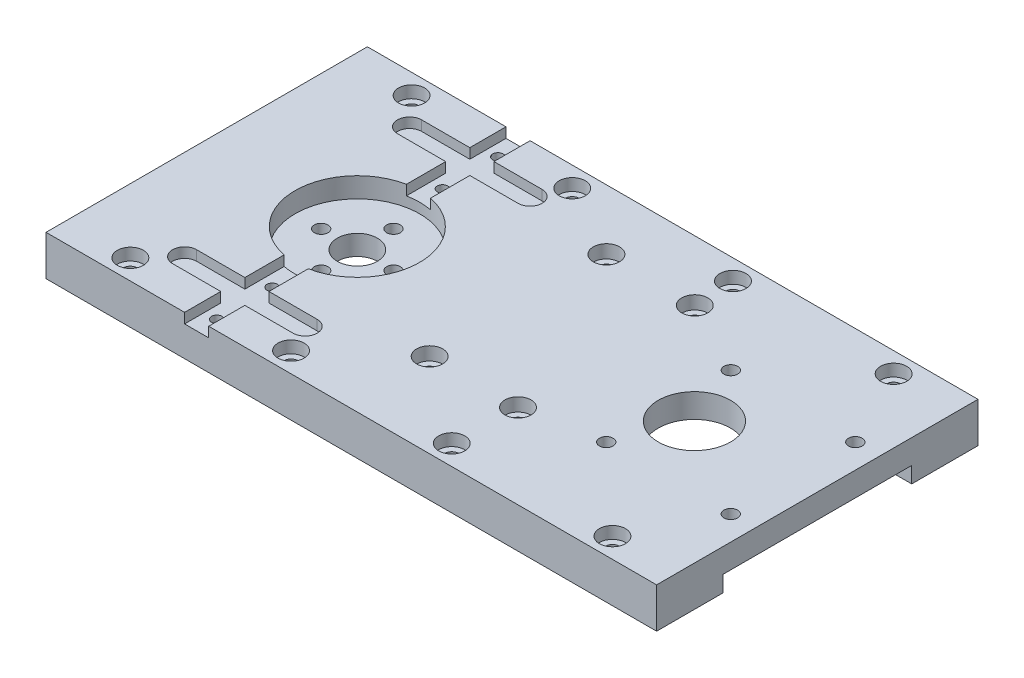
from build123d import *

# Parameters (mm, degrees)
SKETCH1_W                                = 152
SKETCH1_H                                = 80
BOSS_EXTRUDE1_DEPTH                      = 10
SKETCH2_R                                = 15.5
CUT_EXTRUDE1_DEPTH                       = 5
SKETCH3_R                                = 5
CUT_EXTRUDE2_DEPTH                       = 5
CUT_EXTRUDE3_DEPTH                       = 2.5
CIRPATTERN1_COUNT                        = 2
SKETCH5_R                                = 9
CUT_EXTRUDE4_DEPTH                       = 6
SKETCH6_W                                = 47
SKETCH6_H                                = 47
CUT_EXTRUDE5_DEPTH                       = 4
FILLET1_R                                = 3
CBORE_FOR_M3_PAN_HEAD_SCREW1_D           = 3.4
CBORE_FOR_M3_PAN_HEAD_SCREW1_CBORE_D     = 6.5
CBORE_FOR_M3_PAN_HEAD_SCREW1_CBORE_DEPTH = 3
CBORE_FOR_M3_PAN_HEAD_SCREW2_D           = 3.4
CBORE_FOR_M3_PAN_HEAD_SCREW2_CBORE_D     = 6.5
CBORE_FOR_M3_PAN_HEAD_SCREW2_CBORE_DEPTH = 3.3
TAP_DRILL_FOR_M3X0_5_TAP1_D              = 2.6
TAP_DRILL_FOR_M3X0_5_TAP2_D              = 3.4
TAP_DRILL_FOR_M3X0_5_TAP3_D              = 3.4


with BuildPart() as part:
    # Sketch1 → Boss-Extrude1 (new body)
    with BuildSketch(Plane(origin=(0, 0, 0), x_dir=(1, 0, 0), z_dir=(0, 1, 0))):
        with Locations((76, 40)):
            Rectangle(SKETCH1_W, SKETCH1_H)
    extrude(amount=BOSS_EXTRUDE1_DEPTH)

    # Sketch2 → Cut-Extrude1 (cut)
    with BuildSketch(Plane(origin=(0, 10, 0), x_dir=(1, 0, 0), z_dir=(0, 1, 0))):
        with Locations(Location((37.5, 40, 0), (0, 0, 270))):
            Circle(SKETCH2_R)
    extrude(amount=-CUT_EXTRUDE1_DEPTH, mode=Mode.SUBTRACT)

    # Sketch3 → Cut-Extrude2 (cut)
    with BuildSketch(Plane(origin=(0, 5, 0), x_dir=(1, 0, 0), z_dir=(0, 1, 0))):
        with Locations(Location((37.5, 40, 0), (0, 0, 270))):
            Circle(SKETCH3_R)
    extrude(amount=-CUT_EXTRUDE2_DEPTH, mode=Mode.SUBTRACT)

    # Sketch4 → Cut-Extrude3 (cut)
    with BuildSketch(Plane(origin=(0, 10, 0), x_dir=(1, 0, 0), z_dir=(0, 1, 0))):
        with BuildLine():
            Line((34.5, 24.793093674), (34.5, 15))
            Line((34.5, 15), (22.5, 15))
            ThreePointArc((22.5, 15), (19.5, 12), (22.5, 9))
            Line((22.5, 9), (34.5, 9))
            Line((34.5, 9), (34.5, 0))
            Line((34.5, 0), (40.5, 0))
            Line((40.5, 0), (40.5, 9))
            Line((40.5, 9), (52.5, 9))
            ThreePointArc((52.5, 9), (55.5, 12), (52.5, 15))
            Line((52.5, 15), (40.5, 15))
            Line((40.5, 15), (40.5, 24.793093674))
            ThreePointArc((40.5, 24.793093674), (37.5, 24.5), (34.5, 24.793093674))
        make_face()
    cut_extrude3 = extrude(amount=-CUT_EXTRUDE3_DEPTH, mode=Mode.SUBTRACT)

    # CirPattern1: Cut-Extrude3 ×2 about axis
    cirpattern1_axis = Axis((37.5, 0, -40), (0, 1, 0))
    for i in range(1, CIRPATTERN1_COUNT):
        add(cut_extrude3.rotate(cirpattern1_axis, i * 360 / CIRPATTERN1_COUNT), mode=Mode.SUBTRACT)

    # Sketch5 → Cut-Extrude4 (cut)
    with BuildSketch(Plane(origin=(0, 10, 0), x_dir=(1, 0, 0), z_dir=(0, 1, 0))):
        with Locations(Location((121.41, 40, 0), (0, 0, 270))):
            Circle(SKETCH5_R)
    extrude(amount=-CUT_EXTRUDE4_DEPTH, mode=Mode.SUBTRACT)

    # Sketch6 → Cut-Extrude5 (cut)
    with BuildSketch(Plane(origin=(0, 4, 0), x_dir=(1, 0, 0), z_dir=(0, 1, 0))):
        with Locations((128.5, 40)):
            Rectangle(SKETCH6_W, SKETCH6_H)
    extrude(amount=-CUT_EXTRUDE5_DEPTH, mode=Mode.SUBTRACT)

    # Fillet1
    fillet1_edges = [part.edges().sort_by_distance(p)[0] for p in [
        (105, 2, -16.5),
        (105, 2, -63.5),
    ]]
    fillet(fillet1_edges, radius=FILLET1_R)

    # CBORE for M3 Pan Head Screw1 (through all)
    with Locations(Plane(origin=(0, 10, 0), x_dir=(1, 0, 0), z_dir=(0, 1, 0))):
        with Locations((16, 75), (56, 75), (16, 5), (56, 5), (96, 75), (96, 5), (136, 5), (136, 75)):
            CounterBoreHole(CBORE_FOR_M3_PAN_HEAD_SCREW1_D / 2, CBORE_FOR_M3_PAN_HEAD_SCREW1_CBORE_D / 2, CBORE_FOR_M3_PAN_HEAD_SCREW1_CBORE_DEPTH)

    # CBORE for M3 Pan Head Screw2 (through all)
    with Locations(Plane(origin=(0, 10, 0), x_dir=(1, 0, 0), z_dir=(0, 1, 0))):
        with Locations((96.5, 65), (96.5, 21), (74.5, 21), (74.5, 65)):
            CounterBoreHole(CBORE_FOR_M3_PAN_HEAD_SCREW2_D / 2, CBORE_FOR_M3_PAN_HEAD_SCREW2_CBORE_D / 2, CBORE_FOR_M3_PAN_HEAD_SCREW2_CBORE_DEPTH)

    # Tap Drill for M3x0.5 Tap1 (through all)
    with Locations(Plane(origin=(0, 7.5, 0), x_dir=(1, 0, 0), z_dir=(0, 1, 0))):
        with Locations((37.5, 75), (37.5, 61.2), (37.5, 18.8), (37.5, 5)):
            Hole(TAP_DRILL_FOR_M3X0_5_TAP1_D / 2)

    # Tap Drill for M3x0.5 Tap2 (through all)
    with Locations(Plane(origin=(0, 10, 0), x_dir=(1, 0, 0), z_dir=(0, 1, 0))):
        with Locations((114.96, 55.5), (145.96, 55.5), (114.96, 24.5), (145.96, 24.5)):
            Hole(TAP_DRILL_FOR_M3X0_5_TAP2_D / 2)

    # Tap Drill for M3x0.5 Tap3 (through all)
    with Locations(Plane(origin=(0, 5, 0), x_dir=(1, 0, 0), z_dir=(0, 1, 0))):
        with Locations((37.5, 49), (46.5, 40), (28.5, 40), (37.5, 31)):
            Hole(TAP_DRILL_FOR_M3X0_5_TAP3_D / 2)


solid = part.part
